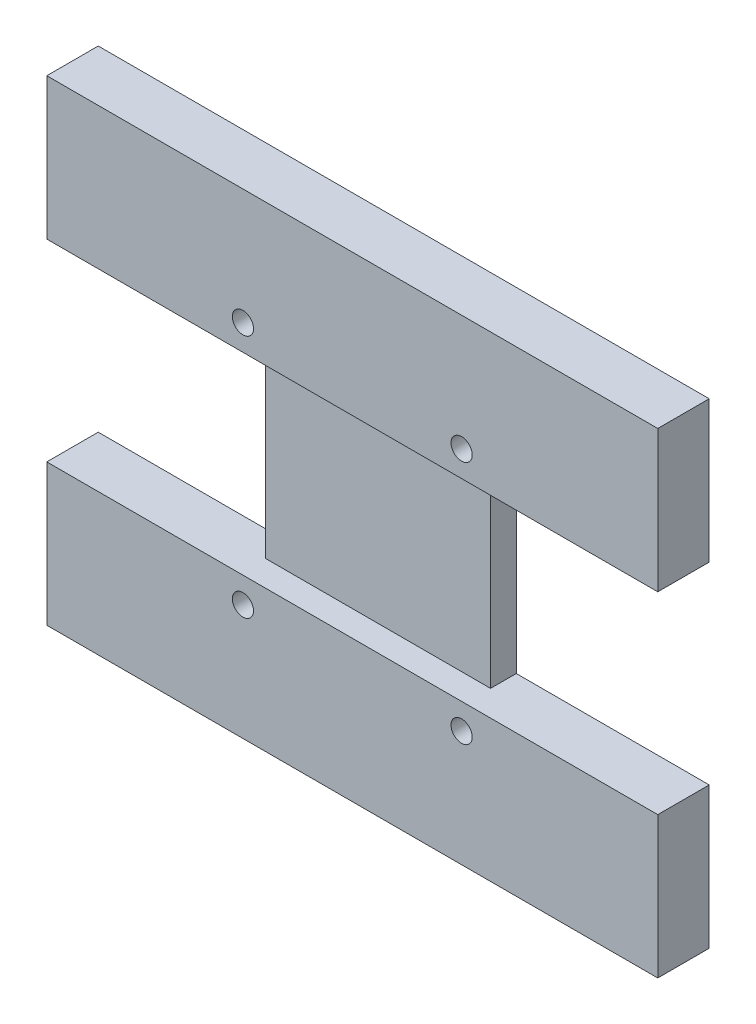
from build123d import *

# Parameters (mm, degrees)
EXTRUDE_1_DEPTH              = 8
SKETCH_2_W                   = 35
SKETCH_2_H                   = 30
CUT_EXTRUDE_1_DEPTH          = 4
HOLE_WIZARD_M4_1_D           = 3.3
HOLE_WIZARD_M4_1_CSINK_D     = 4.05
HOLE_WIZARD_M4_1_CSINK_ANGLE = 90
MIRROR_2_COPY_1_D            = 3.3
MIRROR_2_COPY_1_CSINK_D      = 4.05
MIRROR_2_COPY_1_CSINK_ANGLE  = 90


with BuildPart() as part:
    # 草图1 → 凸台-拉伸1 (new body)
    with BuildSketch(Plane.XY):
        Polygon((47.5, 37), (-47.5, 37), (-47.5, 15), (-17.5, 15), (-17.5, -15), (-47.5, -15), (-47.5, -37), (47.5, -37), (47.5, -15), (17.5, -15), (17.5, 15), (47.5, 15), align=None)
    extrude(amount=EXTRUDE_1_DEPTH)

    # 草图2 → 切除-拉伸1 (cut)
    with BuildSketch(Plane.XY.offset(8)):
        Rectangle(SKETCH_2_W, SKETCH_2_H)
    extrude(amount=-CUT_EXTRUDE_1_DEPTH, mode=Mode.SUBTRACT)

    # M4 螺纹孔1 (through all)
    with Locations(Plane(origin=(17, 19, 0), x_dir=(-1, 0, 0), z_dir=(0, 0, -1))):
        with Locations((0, 0)):
            hole_wizard_m4_1 = CounterSinkHole(HOLE_WIZARD_M4_1_D / 2, HOLE_WIZARD_M4_1_CSINK_D / 2, counter_sink_angle=HOLE_WIZARD_M4_1_CSINK_ANGLE)

    # 镜向1: M4 螺纹孔1 across plane
    add(hole_wizard_m4_1.mirror(Plane.ZX), mode=Mode.SUBTRACT)

    # 镜向2: M4 螺纹孔1 across plane
    add(hole_wizard_m4_1.mirror(Plane(origin=(0, 0, 0), x_dir=(0, 0, 1), z_dir=(1, 0, 0))), mode=Mode.SUBTRACT)

    # 镜向2 copy 1 (through all)
    with Locations(Plane(origin=(-17, -19, 0), x_dir=(1, 0, 0), z_dir=(0, 0, -1))):
        with Locations((0, 0)):
            CounterSinkHole(MIRROR_2_COPY_1_D / 2, MIRROR_2_COPY_1_CSINK_D / 2, counter_sink_angle=MIRROR_2_COPY_1_CSINK_ANGLE)


solid = part.part
